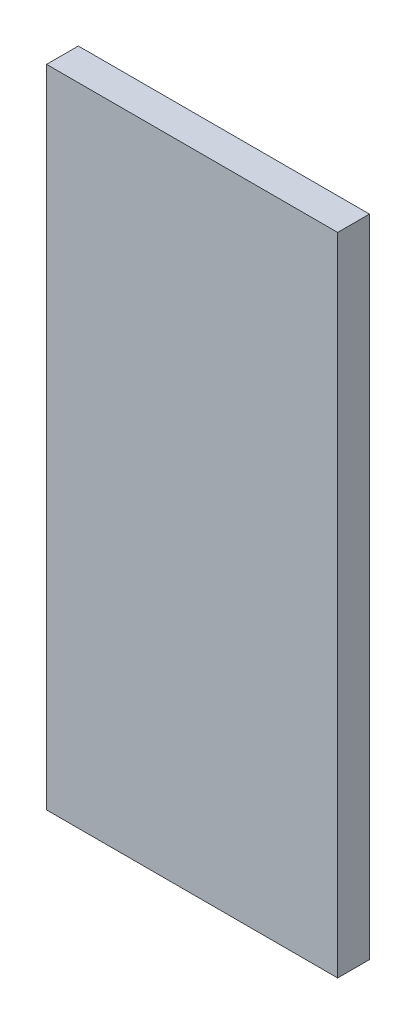
from build123d import *

# Parameters (mm, degrees)
SKETCH1_W           = 27.5
SKETCH1_H           = 61
BOSS_EXTRUDE1_DEPTH = 3


with BuildPart() as part:
    # Sketch1 → Boss-Extrude1 (new body)
    with BuildSketch(Plane.XY):
        Rectangle(SKETCH1_W, SKETCH1_H)
    extrude(amount=BOSS_EXTRUDE1_DEPTH)


solid = part.part
